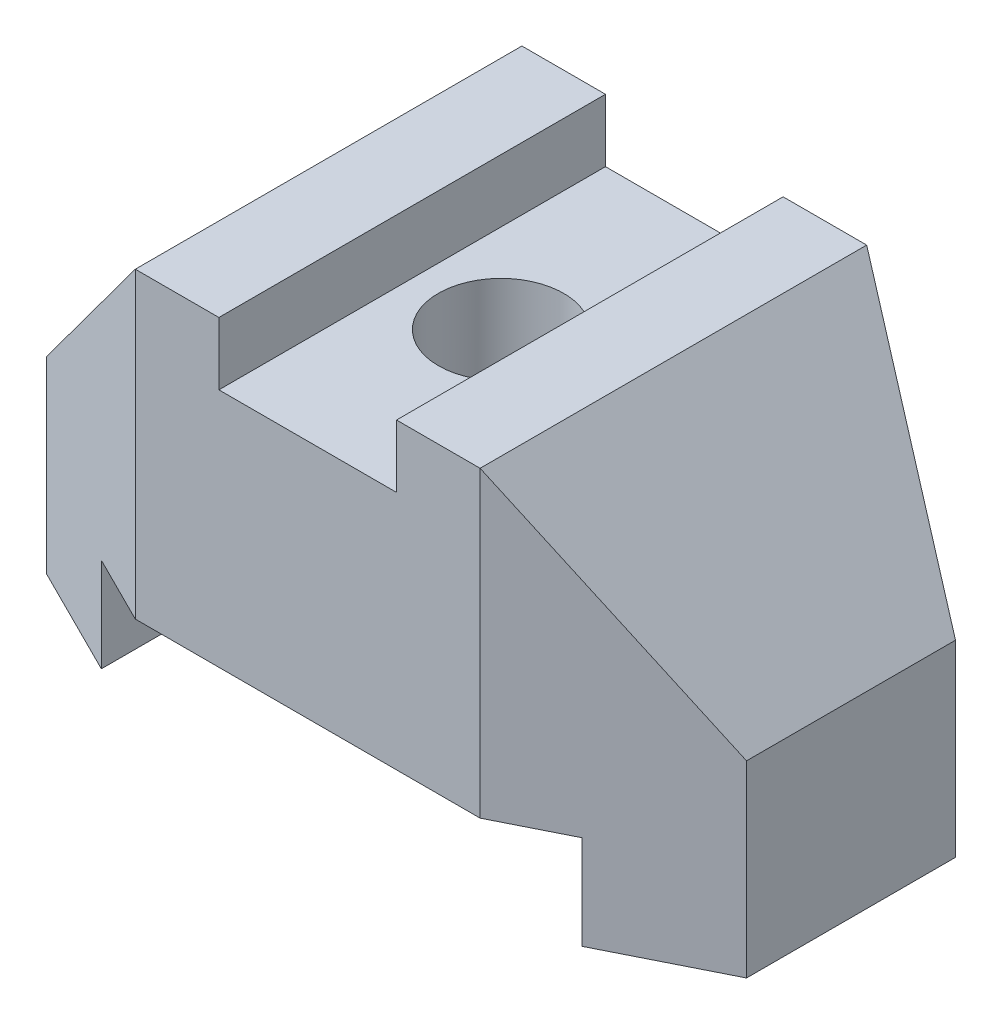
from build123d import *

# Parameters (mm, degrees)
SKETCH_1_W               = 33
SKETCH_1_H               = 37
EXTRUDE_1_DEPTH          = 38
CUT_EXTRUDE_1_DEPTH      = 54.930510845
CUT_EXTRUDE_2_DEPTH      = 54.930510845
CUT_EXTRUDE_2_DEPTH_BACK = 54.930510845
SKETCH_3_W               = 46
SKETCH_3_H               = 9
SKETCH_4_W               = 17
SKETCH_4_H               = 37
CUT_EXTRUDE_3_DEPTH      = 6
SKETCH_5_R               = 6
CUT_EXTRUDE_4_DEPTH      = 50.884867445


with BuildPart() as part:
    # 草图1 → 凸台-拉伸1 (new body)
    with BuildSketch(Plane(origin=(0, 0, 0), x_dir=(1, 0, 0), z_dir=(0, 1, 0))):
        Polygon((-33.5, -10), (-33.5, 10), (-16.5, 18.5), (-16.5, -18.5), align=None)
        Rectangle(SKETCH_1_W, SKETCH_1_H)
        Polygon((33.5, -10), (16.5, -18.5), (16.5, 18.5), (33.5, 10), align=None)
    extrude(amount=EXTRUDE_1_DEPTH)

    # 草图2 → 切除-拉伸1 (cut, symmetric)
    with BuildSketch(Plane.XY):
        Polygon((-80.545432509, 152.17109707), (16.5, 38), (33.5, 18), (130.545432509, -96.17109707), (358.887626649, 97.919767949), (147.79676163, 346.261962088), align=None)
    cut_extrude_1 = extrude(amount=CUT_EXTRUDE_1_DEPTH, both=True, mode=Mode.SUBTRACT)

    # 镜向1: 切除-拉伸1 across plane
    add(cut_extrude_1.mirror(Plane(origin=(0, 0, 0), x_dir=(0, 0, 1), z_dir=(1, 0, 0))), mode=Mode.SUBTRACT)

    # 草图3 → 切除-拉伸2 (cut, two sides: drawn at the far end of the back side and taken through both)
    with BuildSketch(Plane.XY.offset(-CUT_EXTRUDE_2_DEPTH_BACK)):
        with Locations((0, 4.5)):
            Rectangle(SKETCH_3_W, SKETCH_3_H)
    extrude(amount=CUT_EXTRUDE_2_DEPTH + CUT_EXTRUDE_2_DEPTH_BACK, mode=Mode.SUBTRACT)

    # 草图4 → 切除-拉伸3 (cut)
    with BuildSketch(Plane(origin=(0, 38, 0), x_dir=(1, 0, 0), z_dir=(0, 1, 0))):
        Rectangle(SKETCH_4_W, SKETCH_4_H)
    extrude(amount=-CUT_EXTRUDE_3_DEPTH, mode=Mode.SUBTRACT)

    # 草图5 → 切除-拉伸4 (cut, through all)
    with BuildSketch(Plane(origin=(0, 32, 0), x_dir=(1, 0, 0), z_dir=(0, 1, 0))):
        with Locations(Location((0, 0, 0), (0, 0, 270))):
            Circle(SKETCH_5_R)
    extrude(amount=-CUT_EXTRUDE_4_DEPTH, mode=Mode.SUBTRACT)


solid = part.part
